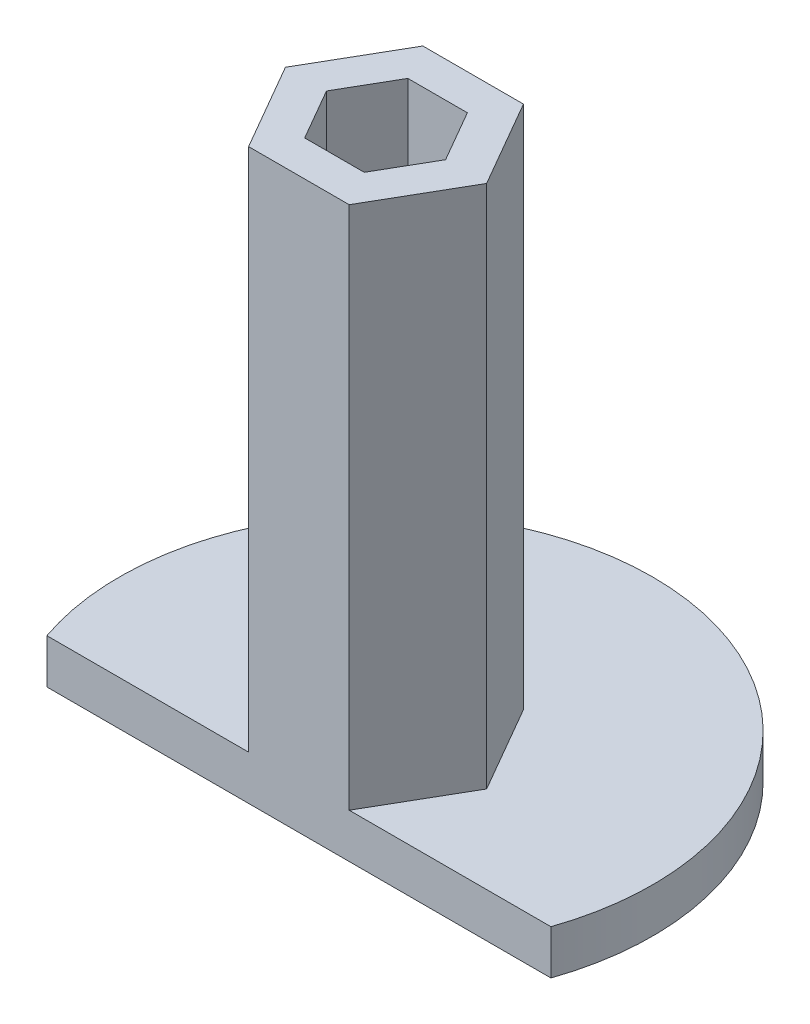
from build123d import *

# Parameters (mm, degrees)
BOSS_EXTRUDE1_DEPTH = 12
BOSS_EXTRUDE2_DEPTH = 17.5
BOSS_EXTRUDE3_DEPTH = 2.5


with BuildPart() as part:
    # Sketch1 → Boss-Extrude1 (new body)
    with BuildSketch(Plane(origin=(0, 0, 0), x_dir=(1, 0, 0), z_dir=(0, 1, 0))):
        Polygon((-2.829700538, 4.901185103), (-5.659401077, 0), (-2.829700538, -4.901185103), (2.829700538, -4.901185103), (5.659401077, 0), (2.829700538, 4.901185103), align=None)
        Polygon((-1.675, 2.901185103), (-3.35, 0), (-1.675, -2.901185103), (1.675, -2.901185103), (3.35, 0), (1.675, 2.901185103), align=None, mode=Mode.SUBTRACT)
    extrude(amount=BOSS_EXTRUDE1_DEPTH)

    # Sketch2 → Boss-Extrude2 (add)
    with BuildSketch(Plane.XZ):
        Polygon((-2.829700538, -4.901185103), (2.829700538, -4.901185103), (5.659401077, 0), (2.829700538, 4.901185103), (-2.829700538, 4.901185103), (-5.659401077, 0), align=None)
    extrude(amount=BOSS_EXTRUDE2_DEPTH)

    # Sketch3 → Boss-Extrude3 (add)
    with BuildSketch(Plane.XZ.offset(17.5)):
        with BuildLine():
            Line((-14.176684542, 4.901185103), (14.176684542, 4.901185103))
            ThreePointArc((14.176684542, 4.901185103), (0, -15), (-14.176684542, 4.901185103))
        make_face()
    extrude(amount=BOSS_EXTRUDE3_DEPTH)


solid = part.part
